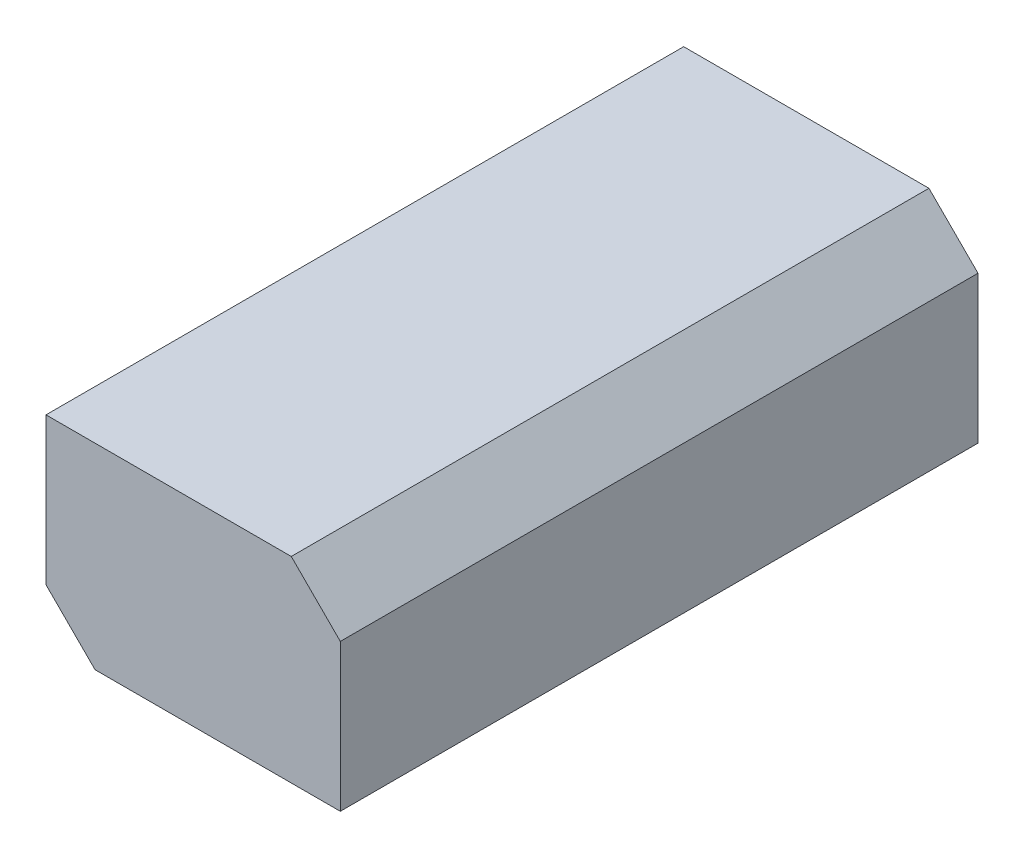
from build123d import *

# Parameters (mm, degrees)
SKETCH_1_W      = 60
SKETCH_1_H      = 40
EXTRUDE_1_DEPTH = 130
CHAMFER_1_SIZE  = 10


with BuildPart() as part:
    # 草图1 → 凸台-拉伸1 (new body)
    with BuildSketch(Plane.XY):
        with Locations((30, -20)):
            Rectangle(SKETCH_1_W, SKETCH_1_H)
    extrude(amount=EXTRUDE_1_DEPTH)

    # 倒角1
    chamfer_1_edges = [part.edges().sort_by_distance(p)[0] for p in [
        (60, 0, 65),
        (0, -40, 65),
    ]]
    chamfer(chamfer_1_edges, length=CHAMFER_1_SIZE)


solid = part.part
